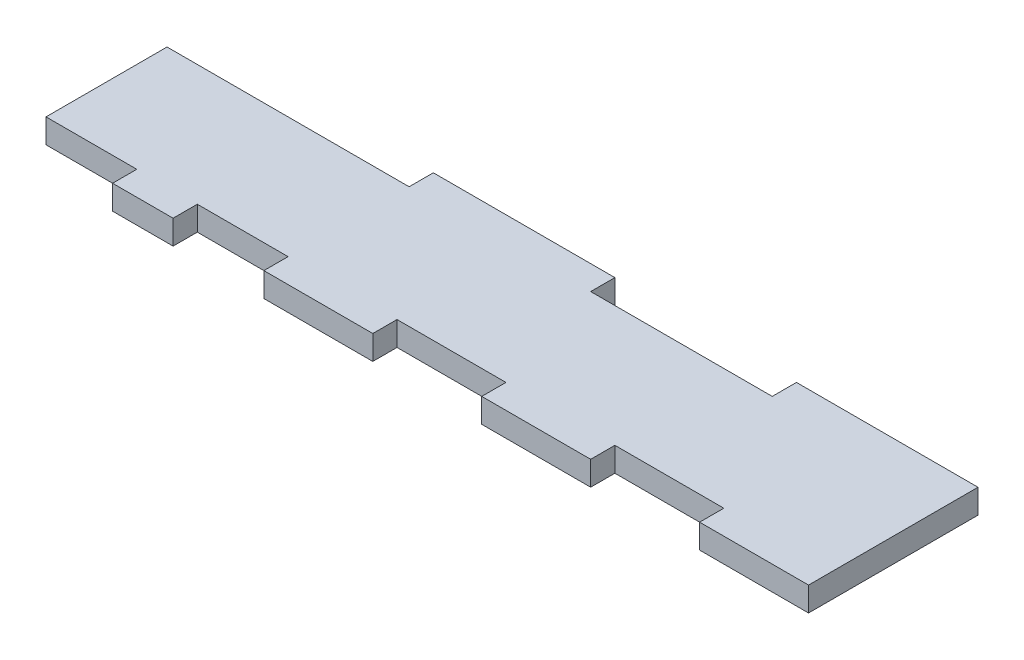
from build123d import *

# Parameters (mm, degrees)
BOSS_EXTRUDE1_DEPTH = 2
SKETCH3_W           = 10
SKETCH3_H           = 4
CUT_EXTRUDE2_DEPTH  = 67.610809934


with BuildPart() as part:
    # Sketch1 → Boss-Extrude1 (new, symmetric)
    with BuildSketch(Plane(origin=(0, 0, 0), x_dir=(1, 0, 0), z_dir=(0, 1, 0))):
        Polygon((-65, -10), (-50, -10), (-50, -14), (-40, -14), (-40, -10), (-25, -10), (-25, -14), (-7, -14), (-7, -10), (11, -10), (11, -14), (29, -14), (29, -10), (47, -10), (47, -14), (65, -14), (65, -10), (65, 10), (65, 14), (35, 14), (35, 10), (5, 10), (5, 14), (-25, 14), (-25, 10), (-55, 10), (-55, 14), (-65, 14), (-65, 10), align=None)
    extrude(amount=BOSS_EXTRUDE1_DEPTH, both=True)

    # Sketch3 → Cut-Extrude2 (cut, through all)
    with BuildSketch(Plane(origin=(0, 2, 0), x_dir=(1, 0, 0), z_dir=(0, 1, 0))):
        with Locations((-60, 12)):
            Rectangle(SKETCH3_W, SKETCH3_H)
    extrude(amount=-CUT_EXTRUDE2_DEPTH, mode=Mode.SUBTRACT)


solid = part.part
